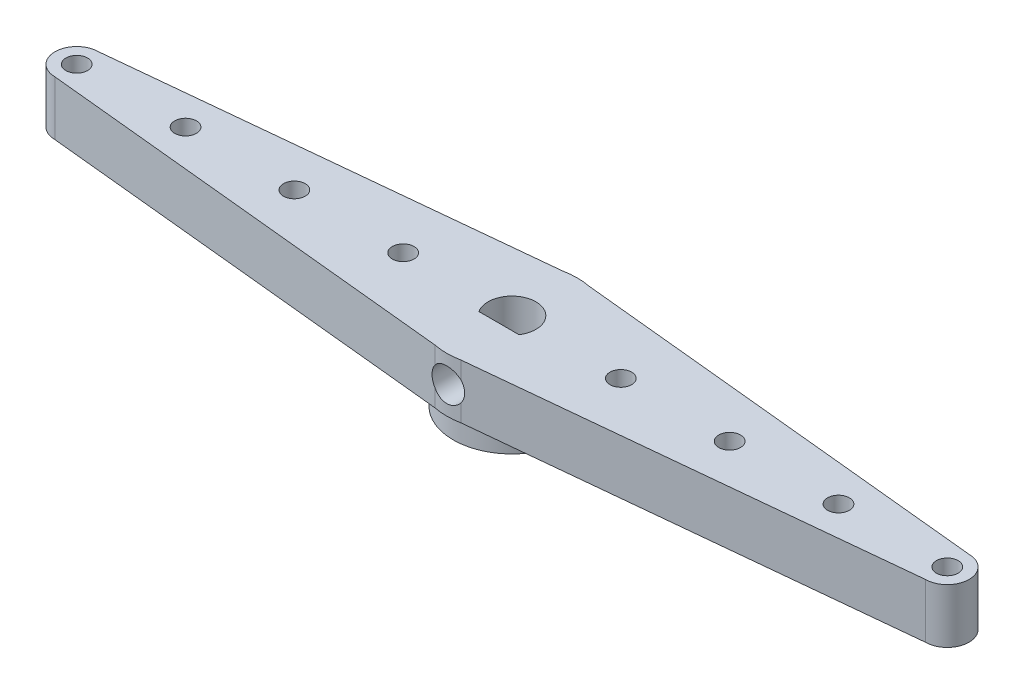
from build123d import *

# Parameters (mm, degrees)
SKETCH1_R           = 0.5
BOSS_EXTRUDE1_DEPTH = 2.5
SKETCH2_R           = 0.75
CUT_EXTRUDE1_DEPTH  = 9
SKETCH3_R           = 2.7
SKETCH3_R_2         = 2
BOSS_EXTRUDE2_DEPTH = 1.1


with BuildPart() as part:
    # Sketch1 → Boss-Extrude1 (new body)
    with BuildSketch(Plane(origin=(0, 0, 0), x_dir=(1, 0, 0), z_dir=(0, 1, 0))):
        with BuildLine():
            Line((0.594059406, 2.940594059), (20, 1))
            ThreePointArc((20, 1), (21, 0), (20, -1))
            Line((20, -1), (0.594059406, -2.940594059))
            ThreePointArc((0.594059406, -2.940594059), (0, -3), (-0.594059406, -2.940594059))
            Line((-0.594059406, -2.940594059), (-20, -1))
            ThreePointArc((-20, -1), (-21, 0), (-20, 1))
            Line((-20, 1), (-0.594059406, 2.940594059))
            ThreePointArc((-0.594059406, 2.940594059), (0, 3), (0.594059406, 2.940594059))
        make_face()
        with Locations(Location((5, 0, 0), (0, 0, 270))):
            Circle(SKETCH1_R, mode=Mode.SUBTRACT)
        with Locations(Location((10, 0, 0), (0, 0, 270))):
            Circle(SKETCH1_R, mode=Mode.SUBTRACT)
        with Locations(Location((15, 0, 0), (0, 0, 270))):
            Circle(SKETCH1_R, mode=Mode.SUBTRACT)
        with Locations(Location((20, 0, 0), (0, 0, 270))):
            Circle(SKETCH1_R, mode=Mode.SUBTRACT)
        with Locations(Location((-20, 0, 0), (0, 0, 90))):
            Circle(SKETCH1_R, mode=Mode.SUBTRACT)
        with Locations(Location((-15, 0, 0), (0, 0, 90))):
            Circle(SKETCH1_R, mode=Mode.SUBTRACT)
        with Locations(Location((-10, 0, 0), (0, 0, 90))):
            Circle(SKETCH1_R, mode=Mode.SUBTRACT)
        with Locations(Location((-5, 0, 0), (0, 0, 90))):
            Circle(SKETCH1_R, mode=Mode.SUBTRACT)
        with BuildLine():
            Line((-0.921954446, -0.6), (0.921954446, -0.6))
            ThreePointArc((0.921954446, -0.6), (0, 1.1), (-0.921954446, -0.6))
        make_face(mode=Mode.SUBTRACT)
    extrude(amount=BOSS_EXTRUDE1_DEPTH)

    # Sketch2 → Cut-Extrude1 (cut)
    with BuildSketch(Plane.XY):
        with Locations(Location((0, 1.25, 0), (0, 0, 180))):
            Circle(SKETCH2_R)
    extrude(amount=CUT_EXTRUDE1_DEPTH, mode=Mode.SUBTRACT)

    # Sketch3 → Boss-Extrude2 (add)
    with BuildSketch(Plane(origin=(0, 0, 0), x_dir=(1, 0, 0), z_dir=(0, 1, 0))):
        with Locations(Location((0, 0, 0), (0, 0, 270))):
            Circle(SKETCH3_R)
        with Locations(Location((0, 0, 0), (0, 0, 270))):
            Circle(SKETCH3_R_2, mode=Mode.SUBTRACT)
    extrude(amount=-BOSS_EXTRUDE2_DEPTH)


solid = part.part
